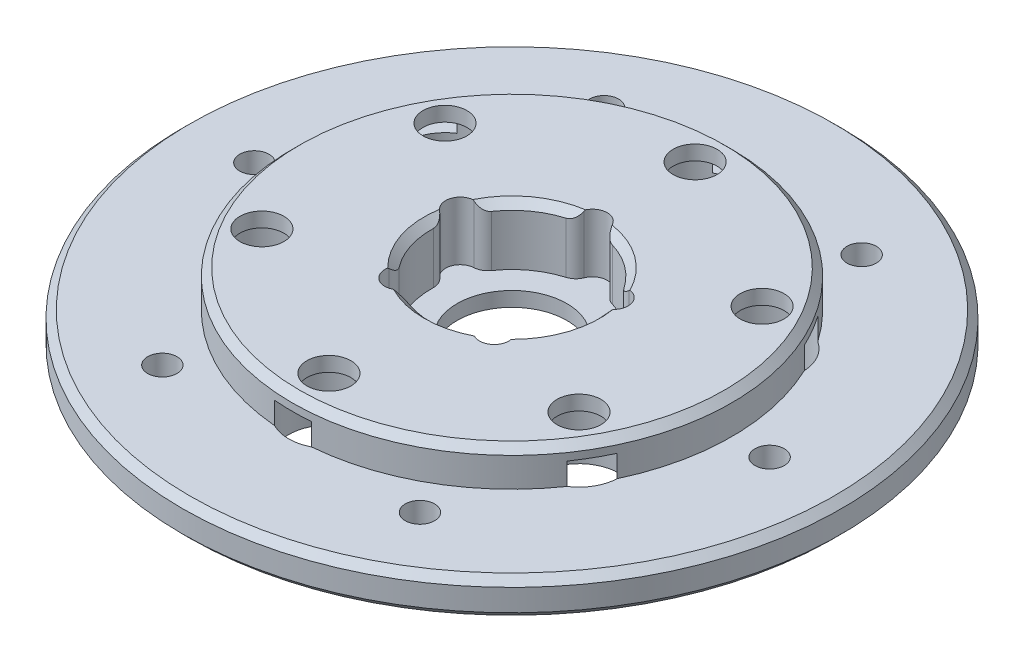
from build123d import *

# Parameters (mm, degrees)
SKETCH1_R           = 45
BOSS_EXTRUDE1_DEPTH = 5
SKETCH2_R           = 30
BOSS_EXTRUDE2_DEPTH = 5
SKETCH3_R           = 3
CUT_EXTRUDE1_DEPTH  = 25
CUT_EXTRUDE2_DEPTH  = 8
SKETCH5_R           = 7.5
CUT_EXTRUDE3_DEPTH  = 5
CHAMFER1_SIZE       = 1
SKETCH6_R           = 5.5
CUT_EXTRUDE8_DEPTH  = 8
CHAMFER2_SIZE       = 1
SKETCH7_R           = 2
CUT_EXTRUDE5_DEPTH  = 28
FILLET1_R           = 2


with BuildPart() as part:
    # Sketch1 → Boss-Extrude1 (new body)
    with BuildSketch(Plane(origin=(0, 0, 0), x_dir=(1, 0, 0), z_dir=(0, 1, 0))):
        with Locations(Location((0, 0, 0), (0, 0, 270))):
            Circle(SKETCH1_R)
    extrude(amount=BOSS_EXTRUDE1_DEPTH)

    # Sketch2 → Boss-Extrude2 (add)
    with BuildSketch(Plane(origin=(0, 5, 0), x_dir=(1, 0, 0), z_dir=(0, 1, 0))):
        with Locations(Location((0, 0, 0), (0, 0, 270))):
            Circle(SKETCH2_R)
    extrude(amount=BOSS_EXTRUDE2_DEPTH)

    # Sketch3 → Cut-Extrude1 (cut)
    with BuildSketch(Plane(origin=(0, 10, 0), x_dir=(1, 0, 0), z_dir=(0, 1, 0))):
        with Locations(Location((0, 25, 0), (0, 0, 270))):
            Circle(SKETCH3_R)
        with Locations(Location((21.650635095, 12.5, 0), (0, 0, 270))):
            Circle(SKETCH3_R)
        with Locations(Location((21.650635095, -12.5, 0), (0, 0, 270))):
            Circle(SKETCH3_R)
        with Locations(Location((0, -25, 0), (0, 0, 270))):
            Circle(SKETCH3_R)
        with Locations(Location((-21.650635095, -12.5, 0), (0, 0, 270))):
            Circle(SKETCH3_R)
        with Locations(Location((-21.650635095, 12.5, 0), (0, 0, 270))):
            Circle(SKETCH3_R)
    extrude(amount=-CUT_EXTRUDE1_DEPTH, mode=Mode.SUBTRACT)

    # Sketch4 → Cut-Extrude2 (cut)
    with BuildSketch(Plane(origin=(0, 10, 0), x_dir=(1, 0, 0), z_dir=(0, 1, 0))):
        with BuildLine():
            ThreePointArc((-1.991718391, 10.818181818), (-6.465637775, 8.899186938), (-9.673227482, 5.237238784))
            ThreePointArc((-9.673227482, 5.237238784), (-12.363734712, 4.017220927), (-10.904177143, 1.448765276))
            ThreePointArc((-10.904177143, 1.448765276), (-10.461621679, -3.399186938), (-7.970101756, -7.581390242))
            ThreePointArc((-7.970101756, -7.581390242), (-7.64120828, -10.517220927), (-4.747433703, -9.922795636))
            ThreePointArc((-4.747433703, -9.922795636), (0, -11), (4.747433703, -9.922795636))
            ThreePointArc((4.747433703, -9.922795636), (7.64120828, -10.517220927), (7.970101756, -7.581390242))
            ThreePointArc((7.970101756, -7.581390242), (10.461621679, -3.399186938), (10.904177143, 1.448765276))
            ThreePointArc((10.904177143, 1.448765276), (12.363734712, 4.017220927), (9.673227482, 5.237238784))
            ThreePointArc((9.673227482, 5.237238784), (6.465637775, 8.899186938), (1.991718391, 10.818181818))
            ThreePointArc((1.991718391, 10.818181818), (0, 13), (-1.991718391, 10.818181818))
        make_face()
    extrude(amount=-CUT_EXTRUDE2_DEPTH, mode=Mode.SUBTRACT)

    # Sketch5 → Cut-Extrude3 (cut)
    with BuildSketch(Plane(origin=(0, 2, 0), x_dir=(1, 0, 0), z_dir=(0, 1, 0))):
        with Locations(Location((0, 0, 0), (0, 0, 270))):
            Circle(SKETCH5_R)
    extrude(amount=-CUT_EXTRUDE3_DEPTH, mode=Mode.SUBTRACT)

    # Chamfer1
    chamfer1_edges = [part.edges().sort_by_distance(p)[0] for p in [
        (0, 0, -45),
        (0, 5, -45),
        (0, 10, -30),
    ]]
    chamfer(chamfer1_edges, length=CHAMFER1_SIZE)

    # Sketch6 → Cut-Extrude8 (cut)
    with BuildSketch(Plane.XZ):
        with Locations(Location((0, 25, 0), (0, 0, 270))):
            Circle(SKETCH6_R)
        with Locations(Location((21.650635095, 12.5, 0), (0, 0, 270))):
            Circle(SKETCH6_R)
        with Locations(Location((21.650635095, -12.5, 0), (0, 0, 270))):
            Circle(SKETCH6_R)
        with Locations(Location((0, -25, 0), (0, 0, 270))):
            Circle(SKETCH6_R)
        with Locations(Location((-21.650635095, -12.5, 0), (0, 0, 270))):
            Circle(SKETCH6_R)
        with Locations(Location((-21.650635095, 12.5, 0), (0, 0, 270))):
            Circle(SKETCH6_R)
    extrude(amount=-CUT_EXTRUDE8_DEPTH, mode=Mode.SUBTRACT)

    # Chamfer2
    chamfer2_edges = [part.edges().sort_by_distance(p)[0] for p in [
        (6.465637775, 10, -8.899186938),
        (-6.465637775, 10, -8.899186938),
        (-10.461621679, 10, 3.399186938),
        (0, 10, 11),
        (10.461621679, 10, 3.399186938),
    ]]
    chamfer(chamfer2_edges, length=CHAMFER2_SIZE)

    # Sketch7 → Cut-Extrude5 (cut)
    with BuildSketch(Plane.XZ):
        with Locations(Location((17.653243546, 30.221895909, 0), (0, 0, 270))):
            Circle(SKETCH7_R)
        with Locations(Location((34.99955138, -0.177209416, 0), (0, 0, 270))):
            Circle(SKETCH7_R)
        with Locations(Location((17.346307834, -30.399105324, 0), (0, 0, 270))):
            Circle(SKETCH7_R)
        with Locations(Location((-17.653243546, -30.221895909, 0), (0, 0, 270))):
            Circle(SKETCH7_R)
        with Locations(Location((-34.99955138, 0.177209416, 0), (0, 0, 270))):
            Circle(SKETCH7_R)
        with Locations(Location((-17.346307834, 30.399105324, 0), (0, 0, 270))):
            Circle(SKETCH7_R)
    extrude(amount=-CUT_EXTRUDE5_DEPTH, mode=Mode.SUBTRACT)

    # Fillet1
    fillet1_edges = [part.edges().sort_by_distance(p)[0] for p in [
        (-4.747433703, 5.5, 9.922795636),
        (4.747433703, 5.5, 9.922795636),
        (7.970101756, 5.5, 7.581390242),
        (10.904177143, 5.5, -1.448765276),
        (9.673227482, 5.5, -5.237238784),
        (1.991718391, 5.5, -10.818181818),
        (-1.991718391, 5.5, -10.818181818),
        (-9.673227482, 5.5, -5.237238784),
        (-10.904177143, 5.5, -1.448765276),
        (-7.970101756, 5.5, 7.581390242),
    ]]
    fillet(fillet1_edges, radius=FILLET1_R)


solid = part.part
